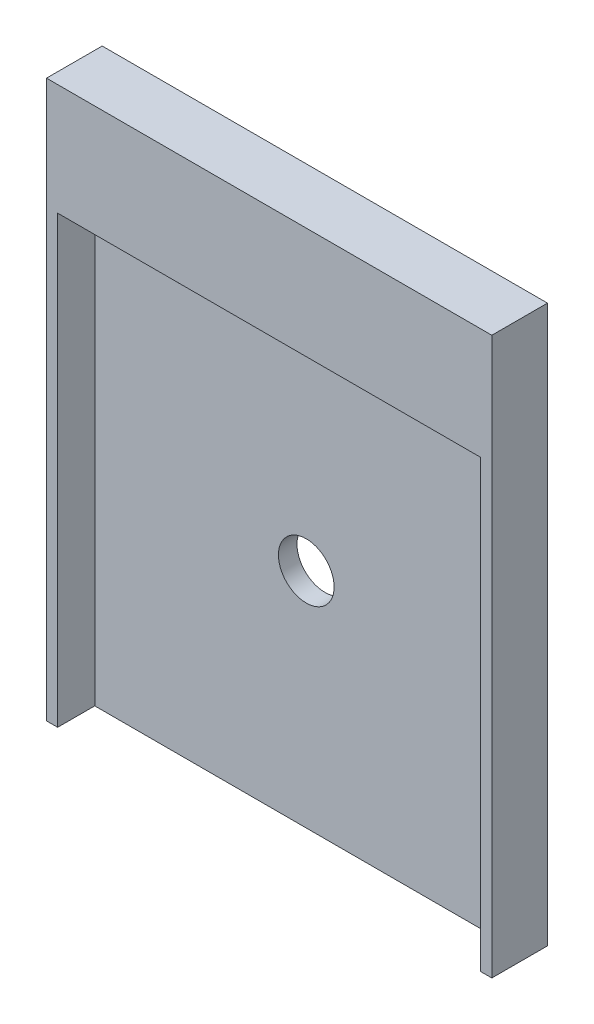
from build123d import *

# Parameters (mm, degrees)
SKETCH1_W           = 120
SKETCH1_H           = 150
BOSS_EXTRUDE1_DEPTH = 5
BOSS_EXTRUDE2_DEPTH = 10
SKETCH4_R           = 7.5
CUT_EXTRUDE1_DEPTH  = 10


with BuildPart() as part:
    # Sketch1 → Boss-Extrude1 (new body)
    with BuildSketch(Plane.XY):
        Rectangle(SKETCH1_W, SKETCH1_H)
    extrude(amount=BOSS_EXTRUDE1_DEPTH)

    # Sketch3 → Boss-Extrude2 (add)
    with BuildSketch(Plane.XY.offset(5)):
        Polygon((-60, 45), (-60, -75), (-57, -75), (-57, 45), (57, 45), (57, -75), (60, -75), (60, 45), (60, 75), (-60, 75), align=None)
    extrude(amount=BOSS_EXTRUDE2_DEPTH)

    # Sketch4 → Cut-Extrude1 (cut)
    with BuildSketch(Plane(origin=(0, 0, 0), x_dir=(-1, 0, 0), z_dir=(0, 0, -1))):
        with Locations((0, -15)):
            Circle(SKETCH4_R)
    extrude(amount=-CUT_EXTRUDE1_DEPTH, mode=Mode.SUBTRACT)


solid = part.part
